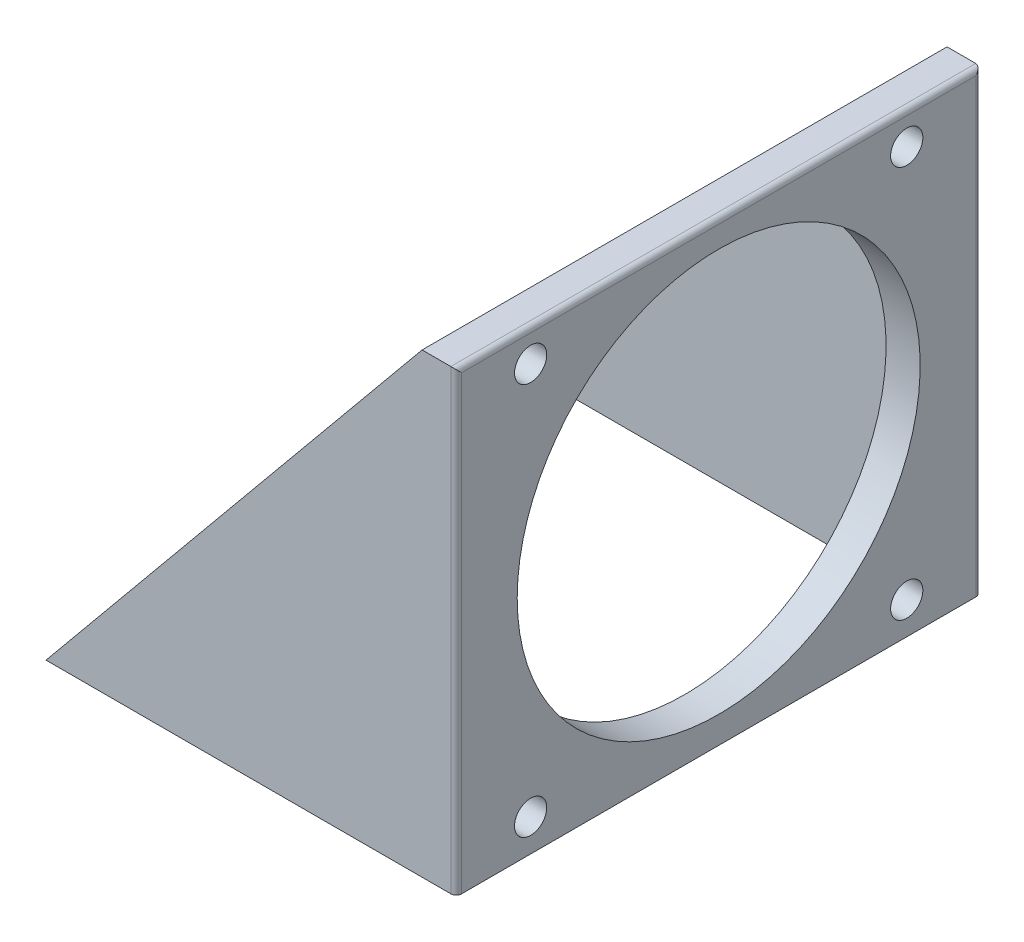
from build123d import *

# Parameters (mm, degrees)
SALIENTE_EXTRUIR1_DEPTH = 97.7
CROQUIS2_W              = 6.35
CROQUIS2_H              = 85
SALIENTE_EXTRUIR2_DEPTH = 70
CORTAR_EXTRUIR1_DEPTH   = 120
CROQUIS4_R              = 37.5
CROQUIS4_R_2            = 3
CORTAR_EXTRUIR2_DEPTH   = 120
CROQUIS5_W              = 30
CROQUIS5_H              = 18.85
CORTAR_EXTRUIR3_DEPTH   = 120
REDONDEO1_R             = 1
CORTAR_EXTRUIR4_DEPTH   = 110


with BuildPart() as part:
    # Croquis1 → Saliente-Extruir1 (new body)
    with BuildSketch(Plane.XY):
        Polygon((34.307403189, -10.15), (4.307403189, -10.15), (4.307403189, 68.5), (-2.042596811, 68.5), (-2.042596811, -16.5), (34.307403189, -16.5), align=None)
    extrude(amount=SALIENTE_EXTRUIR1_DEPTH)

    # Croquis2 → Saliente-Extruir2 (add)
    with BuildSketch(Plane.ZY.offset(2.042596811)):
        with Locations((3.175, 26)):
            Rectangle(CROQUIS2_W, CROQUIS2_H)
        with Locations((94.525, 26)):
            Rectangle(CROQUIS2_W, CROQUIS2_H)
    extrude(amount=SALIENTE_EXTRUIR2_DEPTH)

    # Croquis3 → Cortar-Extruir1 (cut)
    with BuildSketch(Plane.XY.offset(97.7)):
        Polygon((-72.042596811, -16.5), (-2.042596811, 68.5), (-72.042596811, 68.5), align=None)
    extrude(amount=-CORTAR_EXTRUIR1_DEPTH, mode=Mode.SUBTRACT)

    # Croquis4 → Cortar-Extruir2 (cut)
    with BuildSketch(Plane.ZY.offset(2.042596811)):
        with Locations((48.85, 26)):
            Circle(CROQUIS4_R)
        with Locations((13.85, 62.5)):
            Circle(CROQUIS4_R_2)
        with Locations((13.85, -10.5)):
            Circle(CROQUIS4_R_2)
        with Locations(Location((83.85, -10.5, 0), (0, 0, 6.699765178))):
            Circle(CROQUIS4_R_2)
        with Locations((83.85, 62.5)):
            Circle(CROQUIS4_R_2)
    extrude(amount=-CORTAR_EXTRUIR2_DEPTH, mode=Mode.SUBTRACT)

    # Croquis5 → Cortar-Extruir3 (cut)
    with BuildSketch(Plane(origin=(0, -10.15, 0), x_dir=(1, 0, 0), z_dir=(0, 1, 0))):
        with Locations((19.307403189, -9.425)):
            Rectangle(CROQUIS5_W, CROQUIS5_H)
        with Locations((19.307403189, -88.275)):
            Rectangle(CROQUIS5_W, CROQUIS5_H)
    extrude(amount=-CORTAR_EXTRUIR3_DEPTH, mode=Mode.SUBTRACT)

    # Redondeo1
    redondeo1_edges = [part.edges().sort_by_distance(p)[0] for p in [
        (4.307403189, 68.5, 48.85),
        (4.307403189, -13.325, 18.85),
        (4.307403189, 26, 97.7),
        (4.307403189, -13.325, 78.85),
        (4.307403189, -10.15, 28.864333044),
        (4.307403189, 26, 0),
    ]]
    fillet(redondeo1_edges, radius=REDONDEO1_R)

    # Croquis6 → Cortar-Extruir4 (cut)
    with BuildSketch(Plane(origin=(0, 68.5, 0), x_dir=(1, 0, 0), z_dir=(0, 1, 0))):
        Polygon((4.307403189, -1), (83.921067856, -1), (83.921067856, -107.501215509), (4.307403189, -96.7), align=None)
    extrude(amount=-CORTAR_EXTRUIR4_DEPTH, mode=Mode.SUBTRACT)


solid = part.part
